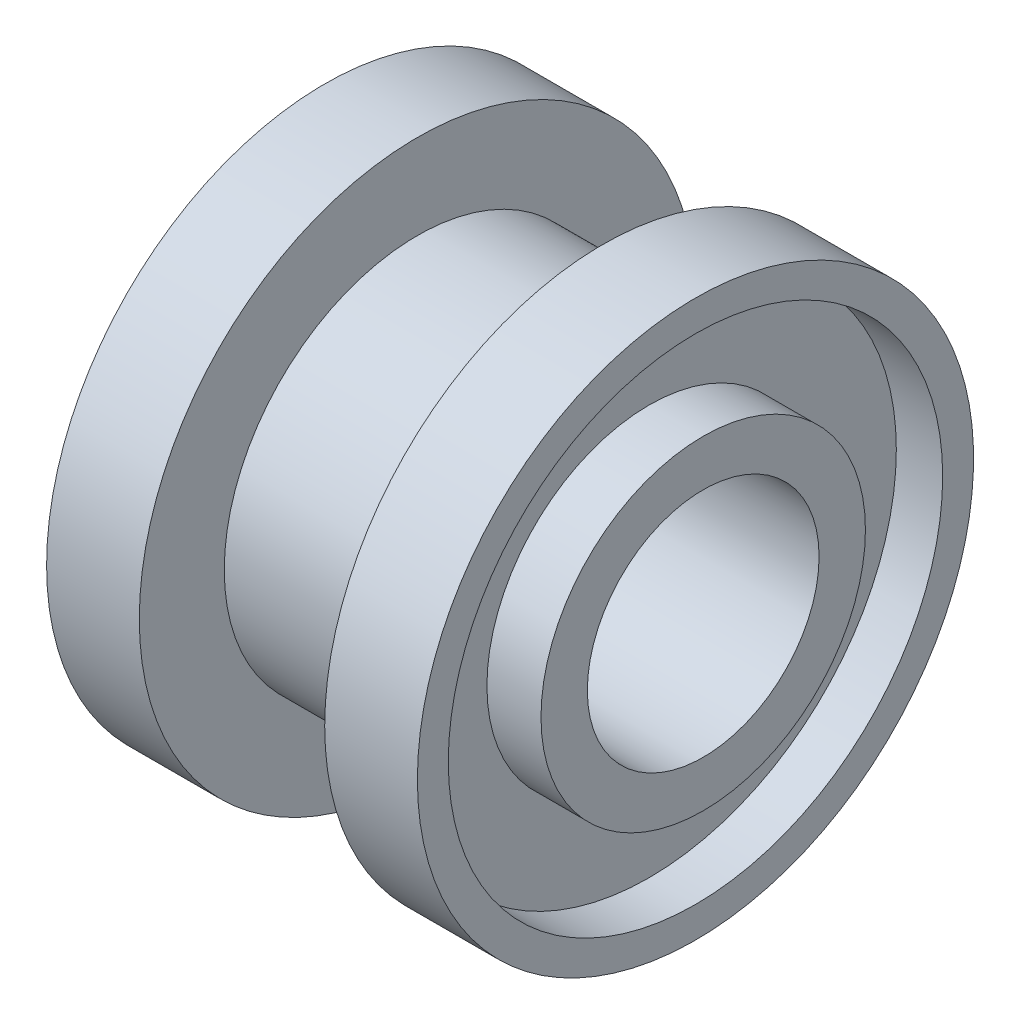
from build123d import *

# Parameters (mm, degrees)
SZKIC2_R                   = 0.5
WYTNIJ_WYCI_GNI_CIE1_DEPTH = 1


with BuildPart() as part:
    # Szkic1 → Obrót1 (revolve)
    with BuildSketch(Plane.XY, mode=Mode.PRIVATE) as obr_t1_sk:
        Polygon((-6, 12.5), (6, 12.5), (6, 18), (12, 18), (12, 16), (9, 16), (9, 10.5), (12.5, 10.5), (12.5, 7.5), (-12.5, 7.5), (-12.5, 10.5), (-9, 10.5), (-9, 16), (-12, 16), (-12, 18), (-6, 18), align=None)
    revolve(obr_t1_sk.sketch.rotate(Axis((-30.837457467, 0, 0), (1, 0, 0)), 90), axis=Axis((-30.837457467, 0, 0), (1, 0, 0)))

    # Szkic2 → Wytnij-wyciągnięcie1 (cut)
    with BuildSketch(Plane.ZY.offset(12)):
        with Locations((0, 17)):
            Circle(SZKIC2_R)
    extrude(amount=-WYTNIJ_WYCI_GNI_CIE1_DEPTH, mode=Mode.SUBTRACT)


solid = part.part
